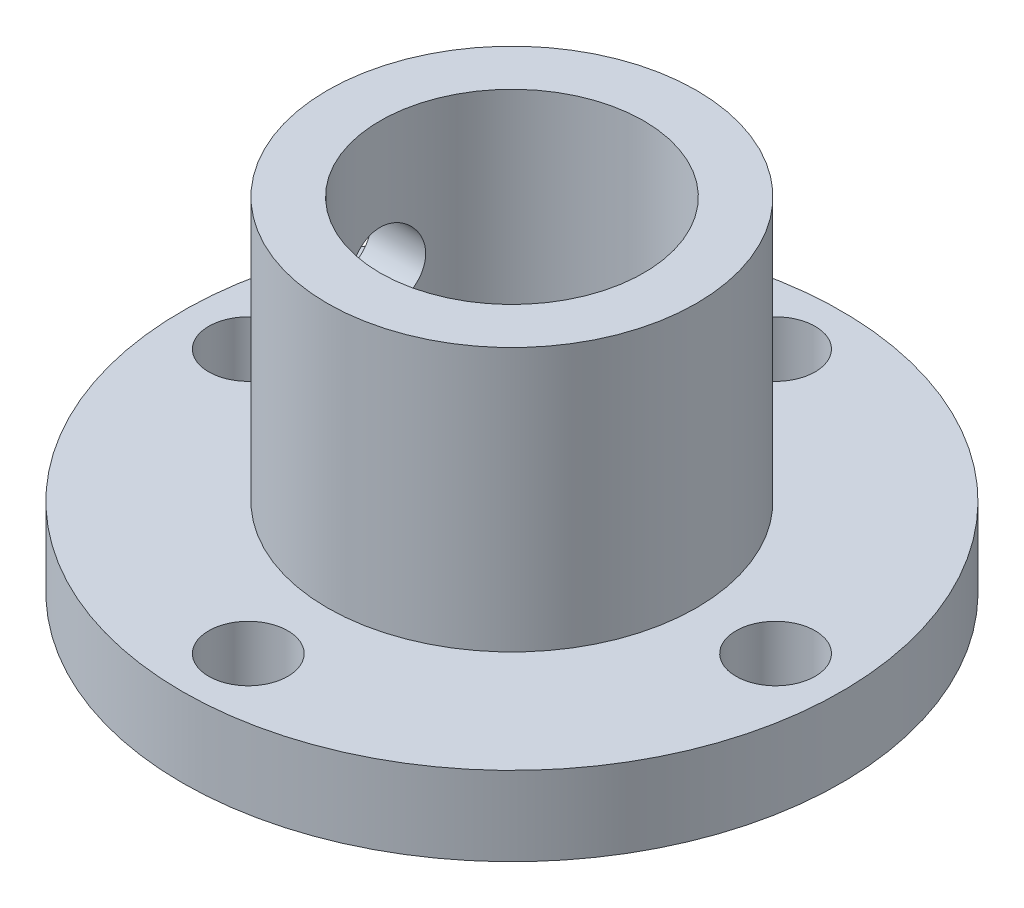
from build123d import *

# Parameters (mm, degrees)
IZIM1_R                     = 12.5
IZIM1_R_2                   = 1.5
Y_KSEKLIK_EKSTR_ZYON1_DEPTH = 3
IZIM2_R                     = 7
IZIM2_R_2                   = 5
EKSTR_ZYON_NCE1_DEPTH       = 10
IZIM3_R                     = 1.5
KES_EKSTR_ZYON1_DEPTH       = 22.943108257


with BuildPart() as part:
    # Çizim1 → Yükseklik-Ekstrüzyon1 (new body)
    with BuildSketch(Plane(origin=(0, 0, 0), x_dir=(1, 0, 0), z_dir=(0, 1, 0))):
        with Locations(Location((0, 0, 0), (0, 0, 270))):
            Circle(IZIM1_R)
        with Locations(Location((10, 0, 0), (0, 0, 270))):
            Circle(IZIM1_R_2, mode=Mode.SUBTRACT)
        with Locations(Location((0, -10, 0), (0, 0, 270))):
            Circle(IZIM1_R_2, mode=Mode.SUBTRACT)
        with Locations(Location((-10, 0, 0), (0, 0, 270))):
            Circle(IZIM1_R_2, mode=Mode.SUBTRACT)
        with Locations(Location((0, 10, 0), (0, 0, 270))):
            Circle(IZIM1_R_2, mode=Mode.SUBTRACT)
    extrude(amount=Y_KSEKLIK_EKSTR_ZYON1_DEPTH)

    # Çizim2 → Ekstrüzyon-İnce1 (add)
    with BuildSketch(Plane(origin=(0, 3, 0), x_dir=(1, 0, 0), z_dir=(0, 1, 0))):
        Circle(IZIM2_R)
        Circle(IZIM2_R_2, mode=Mode.SUBTRACT)
    extrude(amount=EKSTR_ZYON_NCE1_DEPTH)

    # Çizim3 → Kes-Ekstrüzyon1 (cut, through all)
    with BuildSketch(Plane(origin=(0, 0, 0), x_dir=(0, 0, -1), z_dir=(1, 0, 0))):
        with Locations((0, 8)):
            Circle(IZIM3_R)
    extrude(amount=-KES_EKSTR_ZYON1_DEPTH, mode=Mode.SUBTRACT)


solid = part.part
